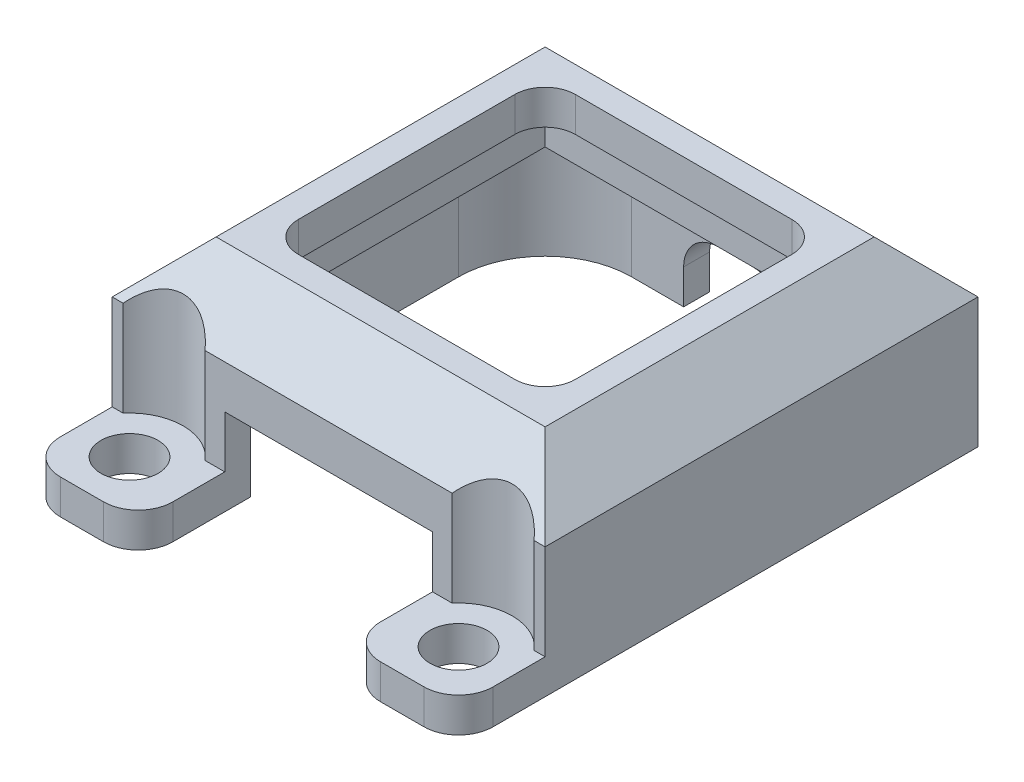
from build123d import *

# Parameters (mm, degrees)
SZKIC1_W                    = 25
SZKIC1_H                    = 25
DODANIE_WYCI_GNI_CIE1_DEPTH = 2
SZKIC2_W                    = 25
SZKIC2_H                    = 25
SZKIC2_W_2                  = 17
SZKIC2_H_2                  = 17
DODANIE_WYCI_GNI_CIE2_DEPTH = 2
SZKIC3_W                    = 25
SZKIC3_H                    = 25
SZKIC3_W_2                  = 22
SZKIC3_H_2                  = 22
DODANIE_WYCI_GNI_CIE3_DEPTH = 6.5
SZKIC4_W                    = 12
SZKIC4_H                    = 5
WYTNIJ_WYCI_GNI_CIE1_DEPTH  = 1.5
SFAZOWANIE1_SIZE            = 3
SZKIC5_W                    = 6.5
SZKIC5_H                    = 5
DODANIE_WYCI_GNI_CIE4_DEPTH = 2
SZKIC8_R                    = 1.65
WYTNIJ_WYCI_GNI_CIE3_DEPTH  = 24.932195888
ZAOKR_GLENIE1_R             = 2
WYTNIJ_WYCI_GNI_CIE4_START  = -2
SZKIC9_R                    = 3.1
WYTNIJ_WYCI_GNI_CIE4_DEPTH  = 22.932195888
ZAOKR_GLENIE1_OF_LUSTRO1_R  = 2
SZKIC6_W                    = 6
SZKIC6_H                    = 4
WYTNIJ_WYCI_GNI_CIE2_DEPTH  = 10
ZAOKR_GLENIE4_R             = 2
ZAOKR_GLENIE5_R             = 5


with BuildPart() as part:
    # Szkic1 → Dodanie-wyciągnięcie1 (new body)
    with BuildSketch(Plane(origin=(0, 0, 0), x_dir=(1, 0, 0), z_dir=(0, 1, 0))):
        Rectangle(SZKIC1_W, SZKIC1_H)
        with BuildLine():
            Line((-6.25, 8), (6.25, 8))
            ThreePointArc((6.25, 8), (7.487436867, 7.487436867), (8, 6.25))
            Line((8, 6.25), (8, -6.25))
            ThreePointArc((8, -6.25), (7.487436867, -7.487436867), (6.25, -8))
            Line((6.25, -8), (-6.25, -8))
            ThreePointArc((-6.25, -8), (-7.487436867, -7.487436867), (-8, -6.25))
            Line((-8, -6.25), (-8, 6.25))
            ThreePointArc((-8, 6.25), (-7.487436867, 7.487436867), (-6.25, 8))
        make_face(mode=Mode.SUBTRACT)
    extrude(amount=-DODANIE_WYCI_GNI_CIE1_DEPTH)

    # Szkic2 → Dodanie-wyciągnięcie2 (add)
    with BuildSketch(Plane.XZ.offset(2)):
        Rectangle(SZKIC2_W, SZKIC2_H)
        Rectangle(SZKIC2_W_2, SZKIC2_H_2, mode=Mode.SUBTRACT)
    extrude(amount=DODANIE_WYCI_GNI_CIE2_DEPTH)

    # Szkic3 → Dodanie-wyciągnięcie3 (add)
    with BuildSketch(Plane.XZ.offset(4)):
        Rectangle(SZKIC3_W, SZKIC3_H)
        Rectangle(SZKIC3_W_2, SZKIC3_H_2, mode=Mode.SUBTRACT)
    extrude(amount=DODANIE_WYCI_GNI_CIE3_DEPTH)

    # Szkic4 → Wytnij-wyciągnięcie1 (cut)
    with BuildSketch(Plane.XY.offset(12.5)):
        with Locations((0, -8)):
            Rectangle(SZKIC4_W, SZKIC4_H)
    extrude(amount=-WYTNIJ_WYCI_GNI_CIE1_DEPTH, mode=Mode.SUBTRACT)

    # Sfazowanie1
    sfazowanie1_edges = [part.edges().sort_by_distance(p)[0] for p in [
        (0, 0, 12.5),
        (-12.5, 0, 0),
        (0, 0, -12.5),
        (12.5, 0, 0),
    ]]
    chamfer(sfazowanie1_edges, length=SFAZOWANIE1_SIZE)

    # Szkic5 → Dodanie-wyciągnięcie4 (add)
    with BuildSketch(Plane.XZ.offset(10.5)):
        with Locations((-9.25, 15)):
            Rectangle(SZKIC5_W, SZKIC5_H)
    dodanie_wyci_gni_cie4 = extrude(amount=-DODANIE_WYCI_GNI_CIE4_DEPTH)

    # Szkic8 → Wytnij-wyciągnięcie3 (cut, through all)
    with BuildSketch(Plane.XZ.offset(10.5)):
        with Locations(Location((-9.5, 14.5, 0), (0, 0, 270))):
            Circle(SZKIC8_R)
    wytnij_wyci_gni_cie3 = extrude(amount=-WYTNIJ_WYCI_GNI_CIE3_DEPTH, mode=Mode.SUBTRACT)

    # Zaokrąglenie1
    zaokr_glenie1_edges = [part.edges().sort_by_distance(p)[0] for p in [
        (-12.5, -9.5, 17.5),
        (-6, -9.5, 17.5),
    ]]
    fillet(zaokr_glenie1_edges, radius=ZAOKR_GLENIE1_R)

    # Szkic9 → Wytnij-wyciągnięcie4 (cut, through all)
    with BuildSketch(Plane.XZ.offset(10.5).offset(WYTNIJ_WYCI_GNI_CIE4_START)):
        with Locations((-9.5, 14.5)):
            Circle(SZKIC9_R)
    wytnij_wyci_gni_cie4 = extrude(amount=-WYTNIJ_WYCI_GNI_CIE4_DEPTH, mode=Mode.SUBTRACT)

    # Lustro1: Dodanie-wyciągnięcie4, Wytnij-wyciągnięcie3, Wytnij-wyciągnięcie4 across plane
    add(dodanie_wyci_gni_cie4.mirror(Plane(origin=(0, 0, 0), x_dir=(0, 0, 1), z_dir=(1, 0, 0))))
    add(wytnij_wyci_gni_cie3.mirror(Plane(origin=(0, 0, 0), x_dir=(0, 0, 1), z_dir=(1, 0, 0))), mode=Mode.SUBTRACT)
    add(wytnij_wyci_gni_cie4.mirror(Plane(origin=(0, 0, 0), x_dir=(0, 0, 1), z_dir=(1, 0, 0))), mode=Mode.SUBTRACT)

    # Zaokrąglenie1 of Lustro1
    zaokr_glenie1_of_lustro1_edges = [part.edges().sort_by_distance(p)[0] for p in [
        (12.5, -9.5, 17.5),
        (6, -9.5, 17.5),
    ]]
    fillet(zaokr_glenie1_of_lustro1_edges, radius=ZAOKR_GLENIE1_OF_LUSTRO1_R)

    # Szkic6 → Wytnij-wyciągnięcie2 (cut)
    with BuildSketch(Plane(origin=(0, 0, -12.5), x_dir=(-1, 0, 0), z_dir=(0, 0, -1))):
        with Locations((0, -8.5)):
            Rectangle(SZKIC6_W, SZKIC6_H)
    extrude(amount=-WYTNIJ_WYCI_GNI_CIE2_DEPTH, mode=Mode.SUBTRACT)

    # Zaokrąglenie4
    zaokr_glenie4_edges = [part.edges().sort_by_distance(p)[0] for p in [
        (3, -6.5, -11.75),
        (-3, -6.5, -11.75),
    ]]
    fillet(zaokr_glenie4_edges, radius=ZAOKR_GLENIE4_R)

    # Zaokrąglenie5
    zaokr_glenie5_edges = [part.edges().sort_by_distance(p)[0] for p in [
        (11, -7.25, -11),
        (-11, -7.25, -11),
        (-11, -7.25, 11),
        (11, -7.25, 11),
    ]]
    fillet(zaokr_glenie5_edges, radius=ZAOKR_GLENIE5_R)


solid = part.part
